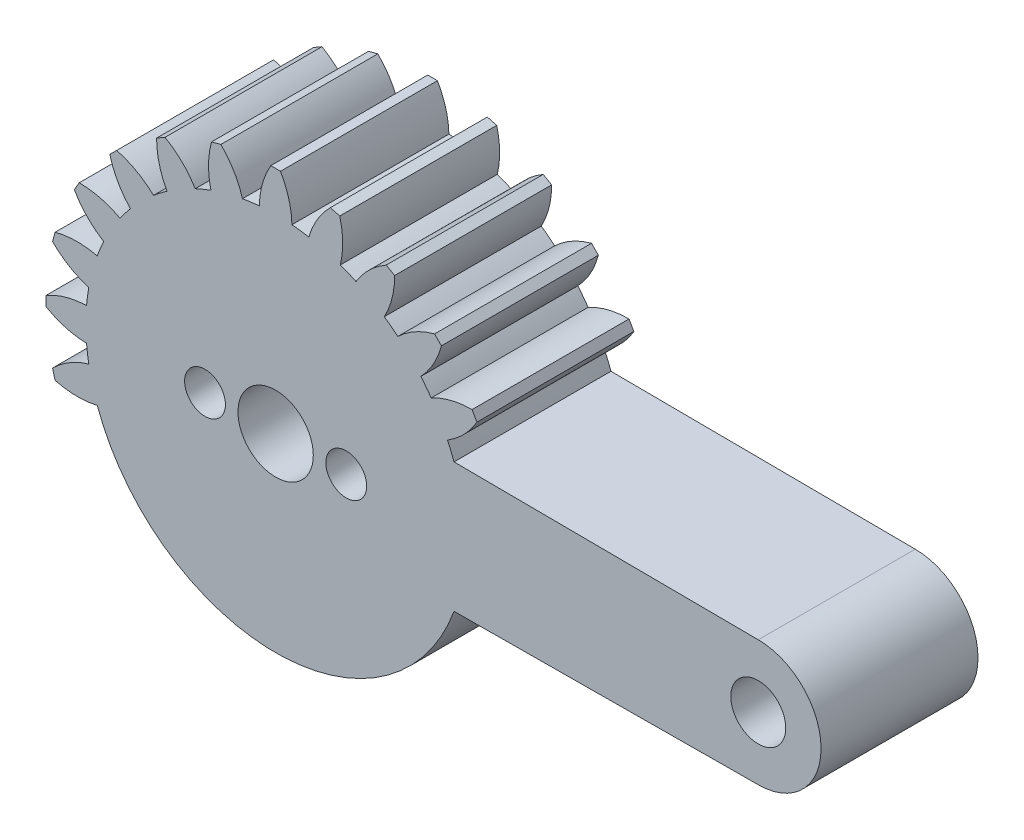
from build123d import *

# Parameters (mm, degrees)
SKETCH1_R            = 1.75
BOSS_EXTRUDE13_DEPTH = 10
SKETCH2_R            = 1.3
SKETCH2_R_2          = 2.4
CUT_EXTRUDE1_DEPTH   = 40.007683858


with BuildPart() as part:
    # Sketch1 → Boss-Extrude13 (new body)
    with BuildSketch(Plane.XY):
        with BuildLine():
            ThreePointArc((1.04, 12.04518576), (0.838273314, 13.383704325), (0.31, 14.63))
            Line((0.31, 14.63), (-0.31, 14.63))
            ThreePointArc((-0.31, 14.63), (-0.838273314, 13.383704325), (-1.04, 12.04518576))
            ThreePointArc((-1.04, 12.04518576), (-1.578061664, 11.986568374), (-2.112960617, 11.903927815))
            ThreePointArc((-2.112960617, 11.903927815), (-2.65424773, 13.144626757), (-3.487085624, 14.211728743))
            Line((-3.487085624, 14.211728743), (-4.085959636, 14.051260935))
            ThreePointArc((-4.085959636, 14.051260935), (-4.273667417, 12.71070456), (-4.122086336, 11.365584201))
            ThreePointArc((-4.122086336, 11.365584201), (-4.626642697, 11.169703548), (-5.12192646, 10.951436862))
            ThreePointArc((-5.12192646, 10.951436862), (-5.965886177, 12.009764599), (-7.046532125, 12.824951657))
            Line((-7.046532125, 12.824951657), (-7.583467875, 12.514951657))
            ThreePointArc((-7.583467875, 12.514951657), (-7.417818147, 11.171491285), (-6.9232593, 9.911436862))
            ThreePointArc((-6.9232593, 9.911436862), (-7.359925677, 9.591641884), (-7.781841479, 9.252623584))
            ThreePointArc((-7.781841479, 9.252623584), (-8.870959341, 10.05645683), (-10.125769107, 10.564175311))
            Line((-10.125769107, 10.564175311), (-10.564175311, 10.125769107))
            ThreePointArc((-10.564175311, 10.125769107), (-10.05645683, 8.870959341), (-9.252623584, 7.781841479))
            ThreePointArc((-9.252623584, 7.781841479), (-9.591641884, 7.359925677), (-9.911436862, 6.9232593))
            ThreePointArc((-9.911436862, 6.9232593), (-11.171491285, 7.417818147), (-12.514951657, 7.583467875))
            Line((-12.514951657, 7.583467875), (-12.824951657, 7.046532125))
            ThreePointArc((-12.824951657, 7.046532125), (-12.009764599, 5.965886177), (-10.951436862, 5.12192646))
            ThreePointArc((-10.951436862, 5.12192646), (-11.169703548, 4.626642697), (-11.365584201, 4.122086336))
            ThreePointArc((-11.365584201, 4.122086336), (-12.71070456, 4.273667417), (-14.051260935, 4.085959636))
            Line((-14.051260935, 4.085959636), (-14.211728743, 3.487085624))
            ThreePointArc((-14.211728743, 3.487085624), (-13.144626757, 2.65424773), (-11.903927815, 2.112960617))
            ThreePointArc((-11.903927815, 2.112960617), (-11.986568374, 1.578061664), (-12.04518576, 1.04))
            ThreePointArc((-12.04518576, 1.04), (-13.383704325, 0.838273314), (-14.63, 0.31))
            Line((-14.63, 0.31), (-14.63, -0.31))
            ThreePointArc((-14.63, -0.31), (-13.383704325, -0.838273314), (-12.04518576, -1.04))
            ThreePointArc((-12.04518576, -1.04), (-11.986568374, -1.578061664), (-11.903927815, -2.112960617))
            ThreePointArc((-11.903927815, -2.112960617), (-13.144626757, -2.65424773), (-14.211728743, -3.487085624))
            Line((-14.211728743, -3.487085624), (-14.051260935, -4.085959636))
            ThreePointArc((-14.051260935, -4.085959636), (-12.71070456, -4.273667417), (-11.365584201, -4.122086336))
            ThreePointArc((-11.365584201, -4.122086336), (0, -12.09), (11.365584201, -4.122086336))
            Line((11.365584201, -4.122086336), (30.75, -4))
            ThreePointArc((30.75, -4), (34.75, 0), (30.75, 4))
            Line((30.75, 4), (11.365584201, 4.122086336))
            ThreePointArc((11.365584201, 4.122086336), (11.169703548, 4.626642697), (10.951436862, 5.12192646))
            ThreePointArc((10.951436862, 5.12192646), (12.009764599, 5.965886177), (12.824951657, 7.046532125))
            Line((12.824951657, 7.046532125), (12.514951657, 7.583467875))
            ThreePointArc((12.514951657, 7.583467875), (11.171491285, 7.417818147), (9.911436862, 6.9232593))
            ThreePointArc((9.911436862, 6.9232593), (9.591641884, 7.359925677), (9.252623584, 7.781841479))
            ThreePointArc((9.252623584, 7.781841479), (10.05645683, 8.870959341), (10.564175311, 10.125769107))
            Line((10.564175311, 10.125769107), (10.125769107, 10.564175311))
            ThreePointArc((10.125769107, 10.564175311), (8.870959341, 10.05645683), (7.781841479, 9.252623584))
            ThreePointArc((7.781841479, 9.252623584), (7.359925677, 9.591641884), (6.9232593, 9.911436862))
            ThreePointArc((6.9232593, 9.911436862), (7.417818147, 11.171491285), (7.583467875, 12.514951657))
            Line((7.583467875, 12.514951657), (7.046532125, 12.824951657))
            ThreePointArc((7.046532125, 12.824951657), (5.965886177, 12.009764599), (5.12192646, 10.951436862))
            ThreePointArc((5.12192646, 10.951436862), (4.626642697, 11.169703548), (4.122086336, 11.365584201))
            ThreePointArc((4.122086336, 11.365584201), (4.273667417, 12.71070456), (4.085959636, 14.051260935))
            Line((4.085959636, 14.051260935), (3.487085624, 14.211728743))
            ThreePointArc((3.487085624, 14.211728743), (2.65424773, 13.144626757), (2.112960617, 11.903927815))
            ThreePointArc((2.112960617, 11.903927815), (1.578061664, 11.986568374), (1.04, 12.04518576))
        make_face()
        Circle(SKETCH1_R, mode=Mode.SUBTRACT)
        with Locations((30.75, 0)):
            Circle(SKETCH1_R, mode=Mode.SUBTRACT)
    extrude(amount=BOSS_EXTRUDE13_DEPTH)

    # Sketch2 → Cut-Extrude1 (cut, through all)
    with BuildSketch(Plane.XY.offset(10)):
        with Locations((-4.5, 0)):
            Circle(SKETCH2_R)
        with Locations((4.5, 0)):
            Circle(SKETCH2_R)
        Circle(SKETCH2_R_2)
    extrude(amount=-CUT_EXTRUDE1_DEPTH, mode=Mode.SUBTRACT)


solid = part.part
